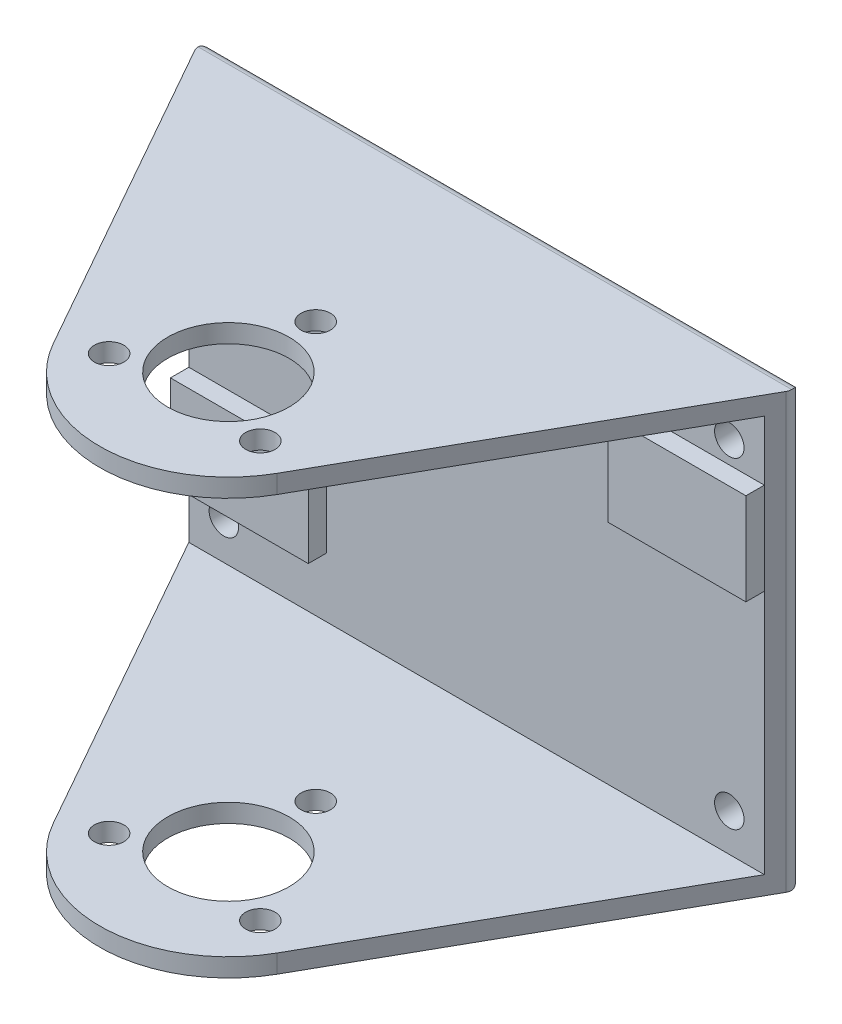
from build123d import *

# Parameters (mm, degrees)
EXTRUDE_1_DEPTH     = 47.2
CUT_EXTRUDE_2_REACH = 77.476
CUT_EXTRUDE_START   = -3
SKETCH_2_W          = 66
SKETCH_2_H          = 43.2
CUT_EXTRUDE_3_REACH = 66.937
SKETCH_3_R          = 1.6
SKETCH_3_R_2        = 6.6
CUT_EXTRUDE_4_REACH = 74.476
SKETCH_4_R          = 1.6
FILLET_1_R          = 1
SKETCH_5_W          = 15
SKETCH_5_H          = 10
EXTRUDE_2_DEPTH     = 2


with BuildPart() as part:
    # 草图1 → 凸台-拉伸1 (new body)
    with BuildSketch(Plane(origin=(0, 0, 0), x_dir=(1, 0, 0), z_dir=(0, 1, 0))):
        with BuildLine():
            Line((33, 30), (12.193267422, -6.879260831))
            ThreePointArc((12.193267422, -6.879260831), (0, -14), (-12.193267422, -6.879260831))
            Line((-12.193267422, -6.879260831), (-33, 30))
            Line((-33, 30), (33, 30))
        make_face()
    extrude(amount=EXTRUDE_1_DEPTH)

    # 草图2 → 切除-拉伸2 (cut, up to next)
    with BuildSketch(Plane(origin=(0, 0, -30), x_dir=(-1, 0, 0), z_dir=(0, 0, -1)).offset(CUT_EXTRUDE_START), mode=Mode.PRIVATE) as cut_extrude_2_sk1:
        with Locations((0, 23.6)):
            Rectangle(SKETCH_2_W, SKETCH_2_H)
    cut_extrude_2_tool1 = extrude(cut_extrude_2_sk1.sketch, amount=-CUT_EXTRUDE_2_REACH, mode=Mode.PRIVATE) & part.part
    add(cut_extrude_2_tool1.solids().sort_by_distance((0, 23.6, -27))[0], mode=Mode.SUBTRACT)

    # 切除-拉伸3: up to this face of the body (flat: up to its plane)
    cut_extrude_3_end = Plane(part.part.faces().sort_by_distance((0, 0, -12.723672626))[0])
    # 草图3 → 切除-拉伸3 (cut, up to the picked face)
    with BuildSketch(Plane(origin=(0, 47.2, 0), x_dir=(1, 0, 0), z_dir=(0, 1, 0)), mode=Mode.PRIVATE) as cut_extrude_3_sk1:
        with Locations(Location((-8.227241336, -4.75, 0), (0, 0, 90))):
            Circle(SKETCH_3_R)
    cut_extrude_3_tool1 = split(extrude(cut_extrude_3_sk1.sketch, amount=-CUT_EXTRUDE_3_REACH, mode=Mode.PRIVATE), bisect_by=cut_extrude_3_end, keep=Keep.BOTH, mode=Mode.PRIVATE)
    # 草图3 → 切除-拉伸3 (cut, up to the picked face)
    with BuildSketch(Plane(origin=(0, 47.2, 0), x_dir=(1, 0, 0), z_dir=(0, 1, 0)), mode=Mode.PRIVATE) as cut_extrude_3_sk2:
        with Locations(Location((8.227241336, -4.75, 0), (0, 0, 90))):
            Circle(SKETCH_3_R)
    cut_extrude_3_tool2 = split(extrude(cut_extrude_3_sk2.sketch, amount=-CUT_EXTRUDE_3_REACH, mode=Mode.PRIVATE), bisect_by=cut_extrude_3_end, keep=Keep.BOTH, mode=Mode.PRIVATE)
    # 草图3 → 切除-拉伸3 (cut, up to the picked face)
    with BuildSketch(Plane(origin=(0, 47.2, 0), x_dir=(1, 0, 0), z_dir=(0, 1, 0)), mode=Mode.PRIVATE) as cut_extrude_3_sk3:
        with Locations(Location((0, 0, 0), (0, 0, 90))):
            Circle(SKETCH_3_R_2)
    cut_extrude_3_tool3 = split(extrude(cut_extrude_3_sk3.sketch, amount=-CUT_EXTRUDE_3_REACH, mode=Mode.PRIVATE), bisect_by=cut_extrude_3_end, keep=Keep.BOTH, mode=Mode.PRIVATE)
    # 草图3 → 切除-拉伸3 (cut, up to the picked face)
    with BuildSketch(Plane(origin=(0, 47.2, 0), x_dir=(1, 0, 0), z_dir=(0, 1, 0)), mode=Mode.PRIVATE) as cut_extrude_3_sk4:
        with Locations(Location((0, 9.5, 0), (0, 0, 90))):
            Circle(SKETCH_3_R)
    cut_extrude_3_tool4 = split(extrude(cut_extrude_3_sk4.sketch, amount=-CUT_EXTRUDE_3_REACH, mode=Mode.PRIVATE), bisect_by=cut_extrude_3_end, keep=Keep.BOTH, mode=Mode.PRIVATE)
    add(cut_extrude_3_tool1.solids().sort_by(Axis((-8.227241, 47.2, 4.75), (0, -1, 0)))[0], mode=Mode.SUBTRACT)
    add(cut_extrude_3_tool2.solids().sort_by(Axis((8.227241, 47.2, 4.75), (0, -1, 0)))[0], mode=Mode.SUBTRACT)
    add(cut_extrude_3_tool3.solids().sort_by(Axis((0, 47.2, 0), (0, -1, 0)))[0], mode=Mode.SUBTRACT)
    add(cut_extrude_3_tool4.solids().sort_by(Axis((0, 47.2, -9.5), (0, -1, 0)))[0], mode=Mode.SUBTRACT)

    # 草图4 → 切除-拉伸4 (cut, up to next)
    with BuildSketch(Plane(origin=(0, 0, -30), x_dir=(-1, 0, 0), z_dir=(0, 0, -1)), mode=Mode.PRIVATE) as cut_extrude_4_sk1:
        with Locations((-27.5, 41.1)):
            Circle(SKETCH_4_R)
    cut_extrude_4_tool1 = extrude(cut_extrude_4_sk1.sketch, amount=-CUT_EXTRUDE_4_REACH, mode=Mode.PRIVATE) & part.part
    # 草图4 → 切除-拉伸4 (cut, up to next)
    with BuildSketch(Plane(origin=(0, 0, -30), x_dir=(-1, 0, 0), z_dir=(0, 0, -1)), mode=Mode.PRIVATE) as cut_extrude_4_sk2:
        with Locations((27.5, 41.1)):
            Circle(SKETCH_4_R)
    cut_extrude_4_tool2 = extrude(cut_extrude_4_sk2.sketch, amount=-CUT_EXTRUDE_4_REACH, mode=Mode.PRIVATE) & part.part
    # 草图4 → 切除-拉伸4 (cut, up to next)
    with BuildSketch(Plane(origin=(0, 0, -30), x_dir=(-1, 0, 0), z_dir=(0, 0, -1)), mode=Mode.PRIVATE) as cut_extrude_4_sk3:
        with Locations((27.5, 6.1)):
            Circle(SKETCH_4_R)
    cut_extrude_4_tool3 = extrude(cut_extrude_4_sk3.sketch, amount=-CUT_EXTRUDE_4_REACH, mode=Mode.PRIVATE) & part.part
    # 草图4 → 切除-拉伸4 (cut, up to next)
    with BuildSketch(Plane(origin=(0, 0, -30), x_dir=(-1, 0, 0), z_dir=(0, 0, -1)), mode=Mode.PRIVATE) as cut_extrude_4_sk4:
        with Locations((-27.5, 6.1)):
            Circle(SKETCH_4_R)
    cut_extrude_4_tool4 = extrude(cut_extrude_4_sk4.sketch, amount=-CUT_EXTRUDE_4_REACH, mode=Mode.PRIVATE) & part.part
    add(cut_extrude_4_tool1.solids().sort_by_distance((27.5, 41.1, -30))[0], mode=Mode.SUBTRACT)
    add(cut_extrude_4_tool2.solids().sort_by_distance((-27.5, 41.1, -30))[0], mode=Mode.SUBTRACT)
    add(cut_extrude_4_tool3.solids().sort_by_distance((-27.5, 6.1, -30))[0], mode=Mode.SUBTRACT)
    add(cut_extrude_4_tool4.solids().sort_by_distance((27.5, 6.1, -30))[0], mode=Mode.SUBTRACT)

    # 圆角1
    fillet_1_edges = [part.edges().sort_by_distance(p)[0] for p in [
        (0, 47.2, -30),
        (0, 0, -30),
        (-33, 23.6, -30),
        (33, 23.6, -30),
    ]]
    fillet(fillet_1_edges, radius=FILLET_1_R)

    # 草图5 → 凸台-拉伸2 (add)
    with BuildSketch(Plane.XY.offset(-27)):
        with Locations((23.807444446, 33.7)):
            Rectangle(SKETCH_5_W, SKETCH_5_H)
        with Locations((-23.807444446, 13.5)):
            Rectangle(SKETCH_5_W, SKETCH_5_H)
    extrude(amount=EXTRUDE_2_DEPTH)


solid = part.part
